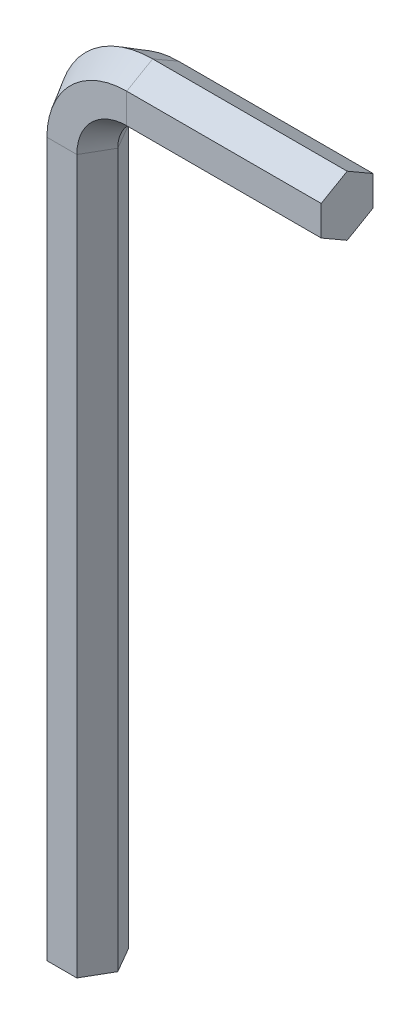
from build123d import *


with BuildPart() as part:
    # Sweep1: sweep along a path in Sketch1
    with BuildLine(Plane.XY) as sweep1_path:
        Line((0, 0), (0, 110))
        ThreePointArc((0, 110), (2.928932188, 117.071067812), (10, 120))
        Line((10, 120), (40, 120))
    # Sketch2 → Sweep1 (sweep)
    with BuildSketch(Plane(origin=(0, 0, 0), x_dir=(1, 0, 0), z_dir=(0, 1, 0))):
        Polygon((4.618802154, 0), (2.309401077, 4), (-2.309401077, 4), (-4.618802154, 0), (-2.309401077, -4), (2.309401077, -4), align=None)
    sweep(path=sweep1_path.line)


solid = part.part
